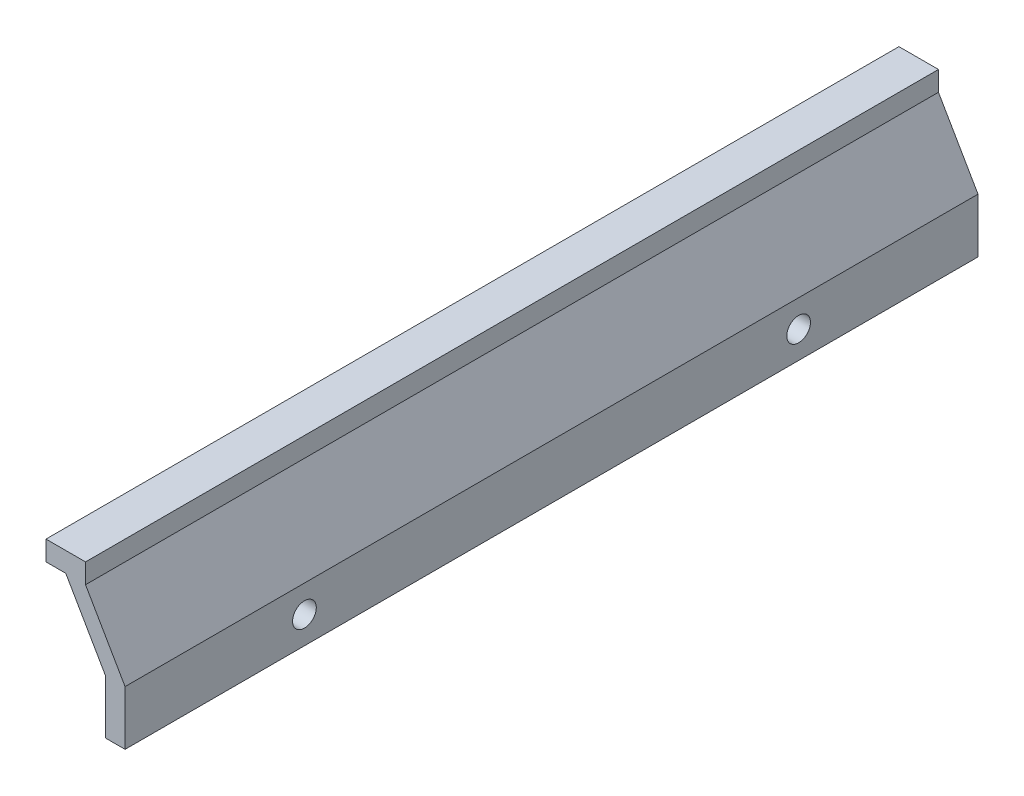
from build123d import *

# Parameters (mm, degrees)
EXTRUDE_1_DEPTH     = 86.3
SKETCH_2_R          = 1.2
CUT_EXTRUDE_1_DEPTH = 88.453247113


with BuildPart() as part:
    # ｽｹｯﾁ1 → ﾎﾞｽ - 押し出し1 (new body)
    with BuildSketch(Plane.XY):
        Polygon((-5, 9.67820323), (-1, 2.75), (-1, -2.75), (1, -2.75), (1, 2.75), (-3, 9.67820323), (-3, 11.67820323), (-5, 11.67820323), (-7, 11.67820323), (-7, 9.67820323), align=None)
    extrude(amount=EXTRUDE_1_DEPTH)

    # ｽｹｯﾁ2 → ｶｯﾄ - 押し出し1 (cut, through all)
    with BuildSketch(Plane(origin=(1, 0, 0), x_dir=(0, 0, -1), z_dir=(1, 0, 0))):
        with Locations((-68.15, 0)):
            Circle(SKETCH_2_R)
        with Locations((-18.15, 0)):
            Circle(SKETCH_2_R)
    extrude(amount=-CUT_EXTRUDE_1_DEPTH, mode=Mode.SUBTRACT)


solid = part.part
